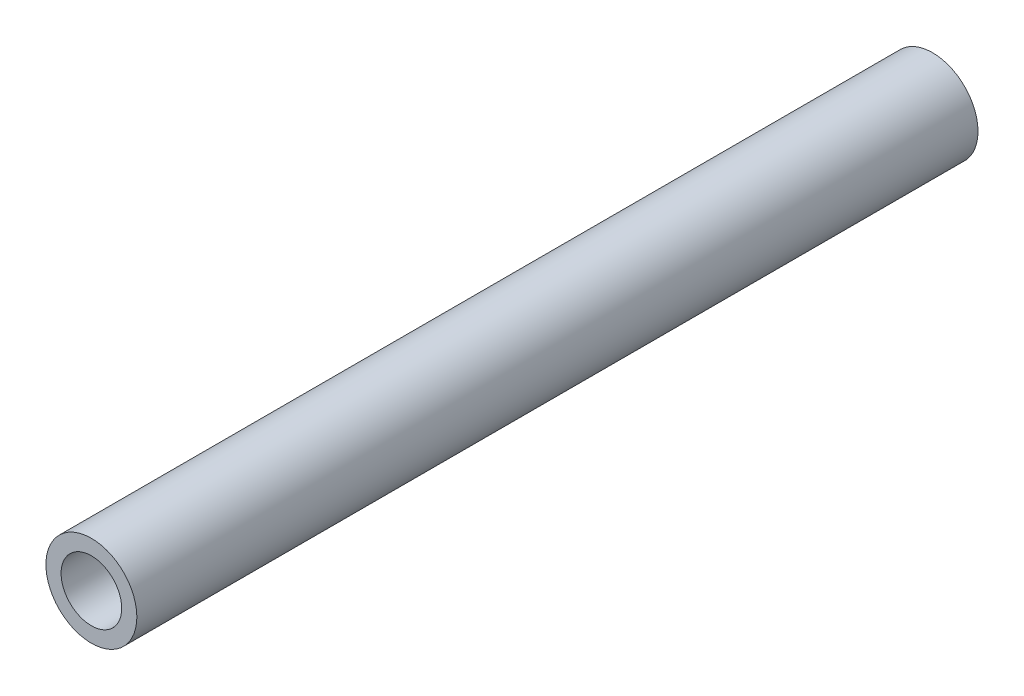
from build123d import *

# Parameters (mm, degrees)
SKETCH_1_R      = 3
SKETCH_1_R_2    = 2
EXTRUDE_1_DEPTH = 55.5


with BuildPart() as part:
    # ｽｹｯﾁ1 → 押し出し-薄板1 (new body)
    with BuildSketch(Plane.XY):
        Circle(SKETCH_1_R)
        Circle(SKETCH_1_R_2, mode=Mode.SUBTRACT)
    extrude(amount=EXTRUDE_1_DEPTH)


solid = part.part
